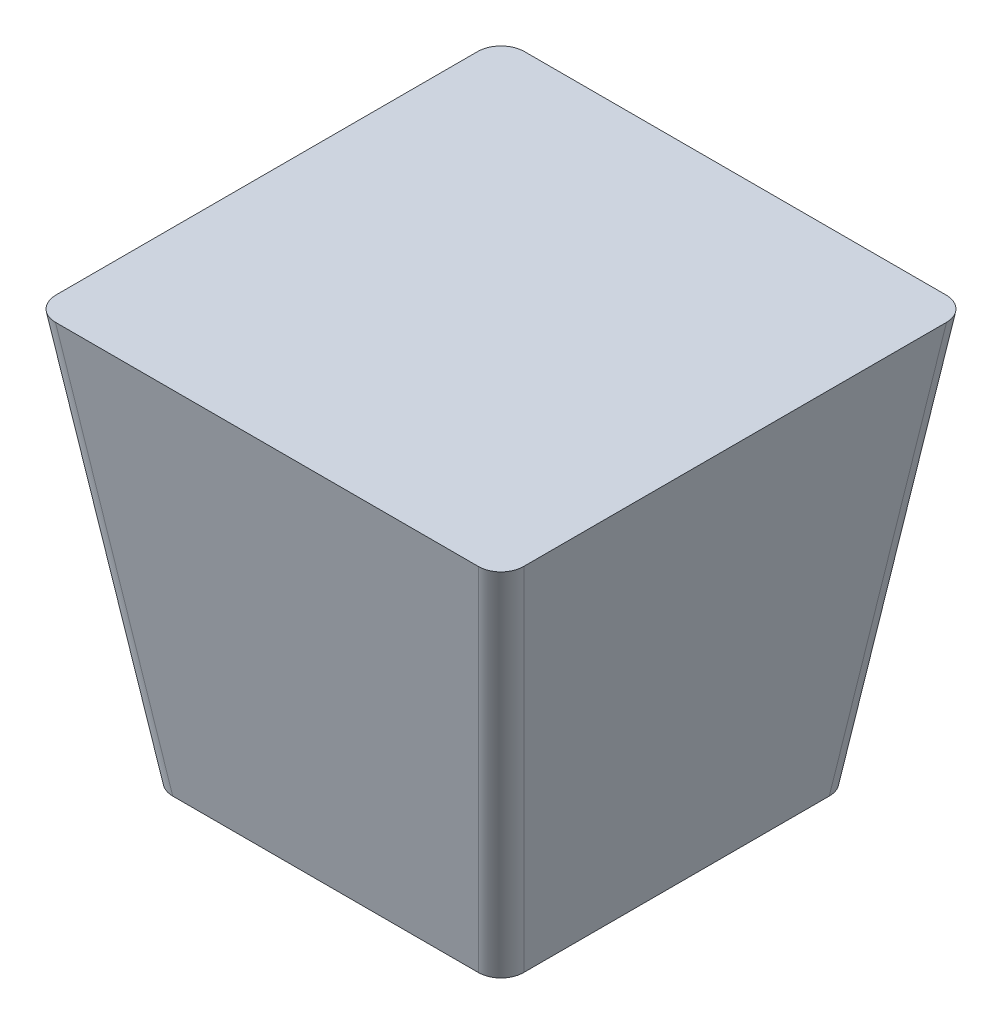
from build123d import *

# Parameters (mm, degrees)
SKETCH_1_W          = 40
SKETCH_1_H          = 40
EXTRUDE_1_DEPTH     = 40
CUT_EXTRUDE_1_DEPTH = 77.035731628
CUT_EXTRUDE_2_DEPTH = 62.629021291
FILLET_1_R          = 2


with BuildPart() as part:
    # Эскиз1 → Бобышка-Вытянуть1 (new body)
    with BuildSketch(Plane(origin=(0, 0, 0), x_dir=(1, 0, 0), z_dir=(0, 1, 0))):
        with Locations((-30.807799443, -4.456824513)):
            Rectangle(SKETCH_1_W, SKETCH_1_H)
    extrude(amount=EXTRUDE_1_DEPTH)

    # Эскиз2 → Вырез-Вытянуть1 (cut, through all)
    with BuildSketch(Plane(origin=(0, 0, -15.543175487), x_dir=(-1, 0, 0), z_dir=(0, 0, -1))):
        Polygon((10.807799443, 40), (10.807799443, 0), (20.807799443, 0), align=None)
    extrude(amount=-CUT_EXTRUDE_1_DEPTH, mode=Mode.SUBTRACT)

    # Эскиз3 → Вырез-Вытянуть2 (cut, through all)
    with BuildSketch(Plane.ZY.offset(50.807799443)):
        Polygon((24.456824513, 0), (14.456824513, 0), (24.456824513, 40), align=None)
    extrude(amount=-CUT_EXTRUDE_2_DEPTH, mode=Mode.SUBTRACT)

    # Скругление1
    fillet_1_edges = [part.edges().sort_by_distance(p)[0] for p in [
        (-15.807799443, 20, -15.543175487),
        (-15.807799443, 20, 19.456824513),
        (-50.807799443, 20, 19.456824513),
        (-50.807799443, 20, -15.543175487),
    ]]
    fillet(fillet_1_edges, radius=FILLET_1_R)


solid = part.part
